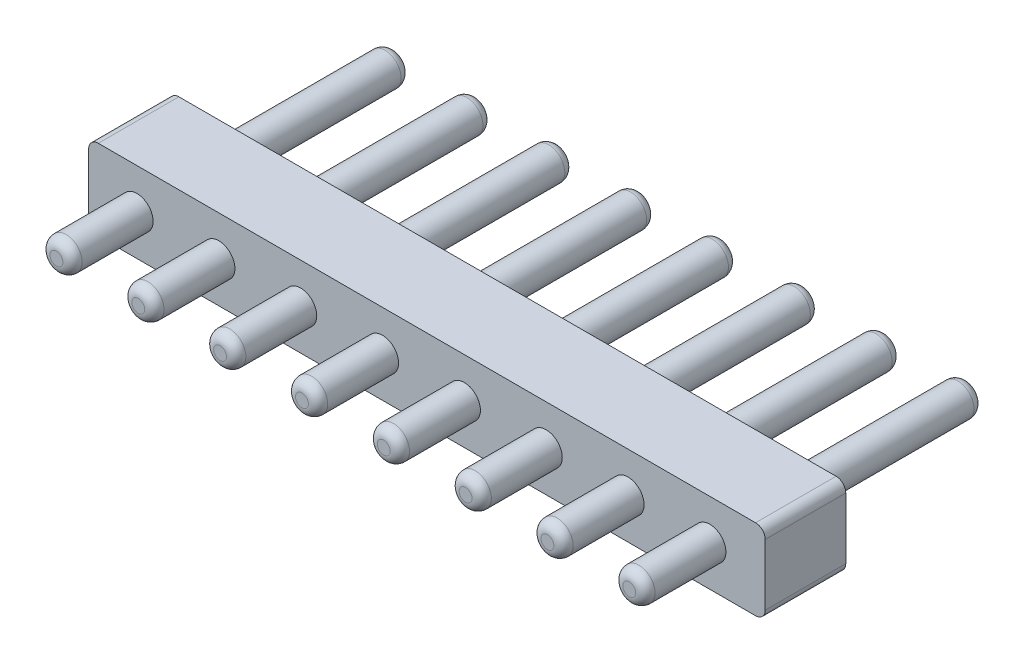
from build123d import *

# Parameters (mm, degrees)
SKETCH1_W                = 21
SKETCH1_H                = 2.5
BOSS_EXTRUDE1_DEPTH      = 2.5
BOSS_EXTRUDE2_DEPTH      = 2.5
BOSS_EXTRUDE2_DEPTH_BACK = 8
SKETCH2_R                = 0.5
FILLET1_R                = 0.3
FILLET2_R                = 0.3


with BuildPart() as part:
    # Sketch1 → Boss-Extrude1 (new body)
    with BuildSketch(Plane.XY):
        Rectangle(SKETCH1_W, SKETCH1_H)
    extrude(amount=BOSS_EXTRUDE1_DEPTH)

    # Sketch2 → Boss-Extrude2 (add, two sides: drawn at the far end of the back side and taken through both)
    with BuildSketch(Plane.XY.offset(2.5).offset(-BOSS_EXTRUDE2_DEPTH_BACK)):
        with Locations((-9, 0)):
            Circle(SKETCH2_R)
        with Locations((-6.46, 0)):
            Circle(SKETCH2_R)
        with Locations((-3.92, 0)):
            Circle(SKETCH2_R)
        with Locations((-1.38, 0)):
            Circle(SKETCH2_R)
        with Locations((1.16, 0)):
            Circle(SKETCH2_R)
        with Locations((3.7, 0)):
            Circle(SKETCH2_R)
        with Locations((6.24, 0)):
            Circle(SKETCH2_R)
        with Locations((8.78, 0)):
            Circle(SKETCH2_R)
    extrude(amount=BOSS_EXTRUDE2_DEPTH + BOSS_EXTRUDE2_DEPTH_BACK)

    # Fillet1
    fillet1_edges = [part.edges().sort_by_distance(p)[0] for p in [
        (-9.5, 0, -5.5),
        (-9.5, 0, 5),
        (-6.96, 0, -5.5),
        (-6.96, 0, 5),
        (-4.42, 0, -5.5),
        (-4.42, 0, 5),
        (-1.88, 0, -5.5),
        (-1.88, 0, 5),
        (0.66, 0, -5.5),
        (0.66, 0, 5),
        (3.2, 0, -5.5),
        (3.2, 0, 5),
        (5.74, 0, -5.5),
        (5.74, 0, 5),
        (8.28, 0, -5.5),
        (8.28, 0, 5),
    ]]
    fillet(fillet1_edges, radius=FILLET1_R)

    # Fillet2
    fillet2_edges = [part.edges().sort_by_distance(p)[0] for p in [
        (10.5, -1.25, 1.25),
        (-10.5, -1.25, 1.25),
        (-10.5, 1.25, 1.25),
        (10.5, 1.25, 1.25),
    ]]
    fillet(fillet2_edges, radius=FILLET2_R)


solid = part.part
